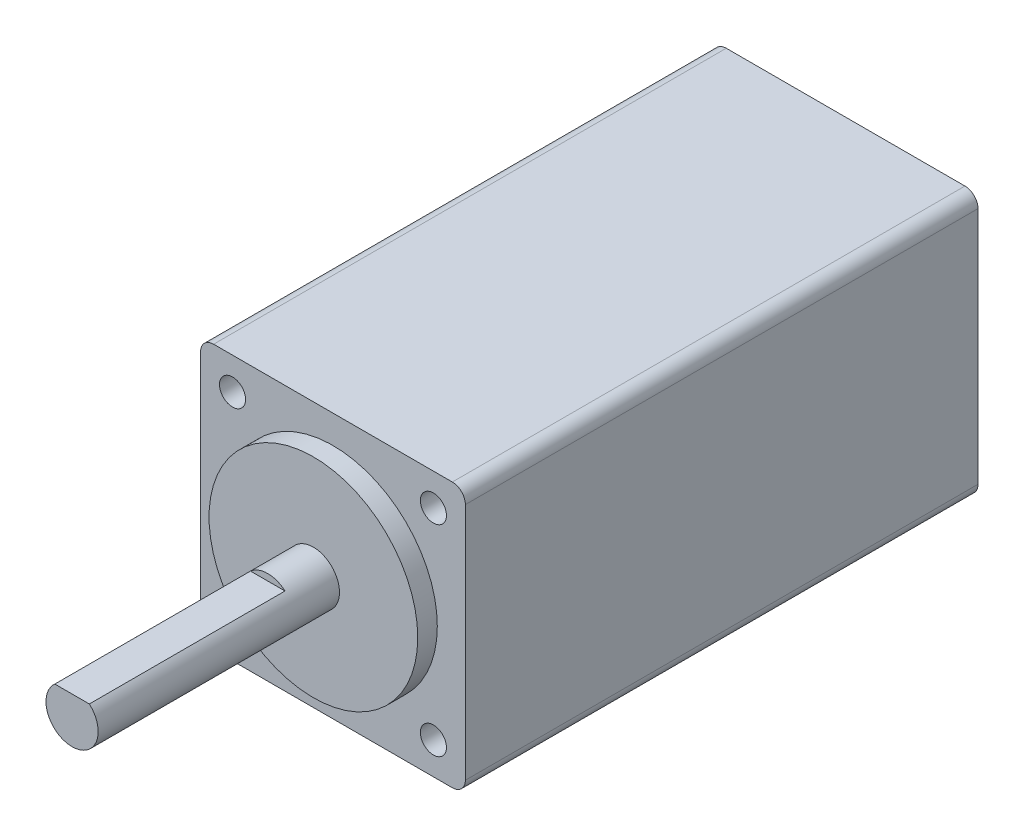
from build123d import *

# Parameters (mm, degrees)
SKETCH1_W           = 20.3
SKETCH1_H           = 20.3
BOSS_EXTRUDE1_DEPTH = 39.3
FILLET1_R           = 1
SKETCH2_R           = 1
CUT_EXTRUDE1_DEPTH  = 2.5
SKETCH3_R           = 8
BOSS_EXTRUDE2_DEPTH = 1.5
SKETCH5_R           = 2
BOSS_EXTRUDE3_DEPTH = 20
CUT_EXTRUDE2_START  = -15
CUT_EXTRUDE2_DEPTH  = 15


with BuildPart() as part:
    # Sketch1 → Boss-Extrude1 (new body)
    with BuildSketch(Plane.XY):
        Rectangle(SKETCH1_W, SKETCH1_H)
    extrude(amount=BOSS_EXTRUDE1_DEPTH)

    # Fillet1
    fillet1_edges = [part.edges().sort_by_distance(p)[0] for p in [
        (-10.15, 10.15, 19.65),
        (10.15, 10.15, 19.65),
        (10.15, -10.15, 19.65),
        (-10.15, -10.15, 19.65),
    ]]
    fillet(fillet1_edges, radius=FILLET1_R)

    # Sketch2 → Cut-Extrude1 (cut)
    with BuildSketch(Plane.XY.offset(39.3)):
        with Locations((-7.7, 7.7)):
            Circle(SKETCH2_R)
        with Locations((-7.7, -7.7)):
            Circle(SKETCH2_R)
        with Locations((7.7, -7.7)):
            Circle(SKETCH2_R)
        with Locations((7.7, 7.7)):
            Circle(SKETCH2_R)
    extrude(amount=-CUT_EXTRUDE1_DEPTH, mode=Mode.SUBTRACT)

    # Sketch3 → Boss-Extrude2 (add)
    with BuildSketch(Plane.XY.offset(39.3)):
        Circle(SKETCH3_R)
    extrude(amount=BOSS_EXTRUDE2_DEPTH)

    # Sketch5 → Boss-Extrude3 (add)
    with BuildSketch(Plane.XY.offset(39.3)):
        Circle(SKETCH5_R)
    extrude(amount=BOSS_EXTRUDE3_DEPTH)

    # Sketch6 → Cut-Extrude2 (cut)
    with BuildSketch(Plane.XY.offset(59.3).offset(CUT_EXTRUDE2_START)):
        with BuildLine():
            Line((-1.322875656, 1.5), (1.322875656, 1.5))
            ThreePointArc((1.322875656, 1.5), (0, 2), (-1.322875656, 1.5))
        make_face()
    extrude(amount=CUT_EXTRUDE2_DEPTH, mode=Mode.SUBTRACT)


solid = part.part
